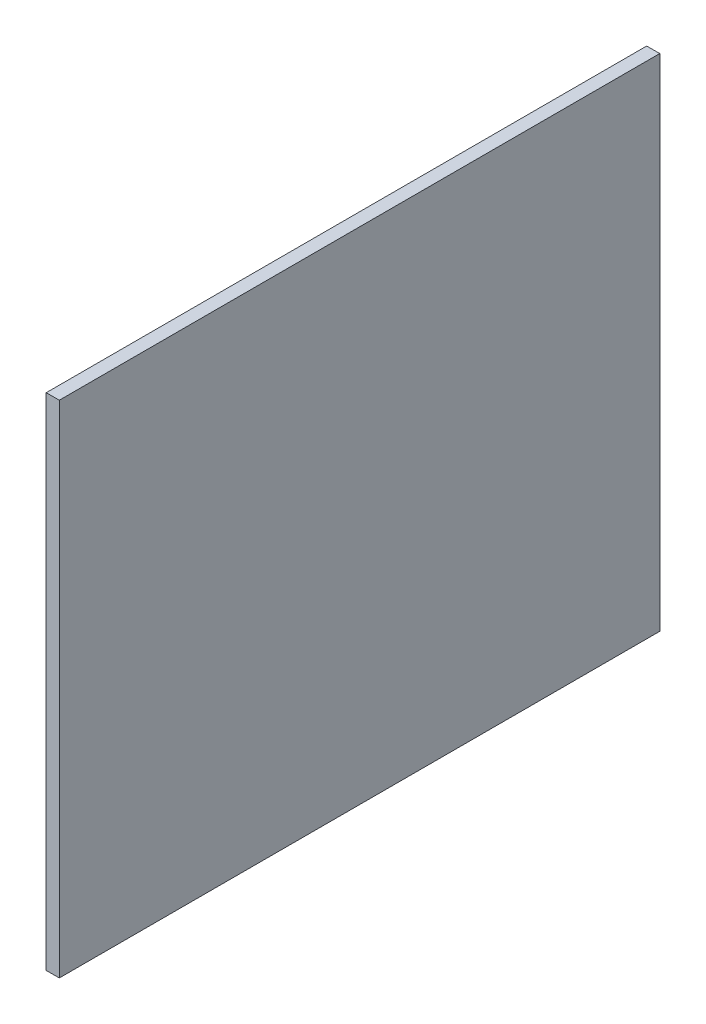
from build123d import *

# Parameters (mm, degrees)
SKETCH_1_W      = 276
SKETCH_1_H      = 230
EXTRUDE_1_DEPTH = 6


with BuildPart() as part:
    # 草图1 → 凸台-拉伸1 (new body)
    with BuildSketch(Plane(origin=(0, 0, 0), x_dir=(0, 0, -1), z_dir=(1, 0, 0))):
        with Locations((138, 115)):
            Rectangle(SKETCH_1_W, SKETCH_1_H)
    extrude(amount=EXTRUDE_1_DEPTH)


solid = part.part
